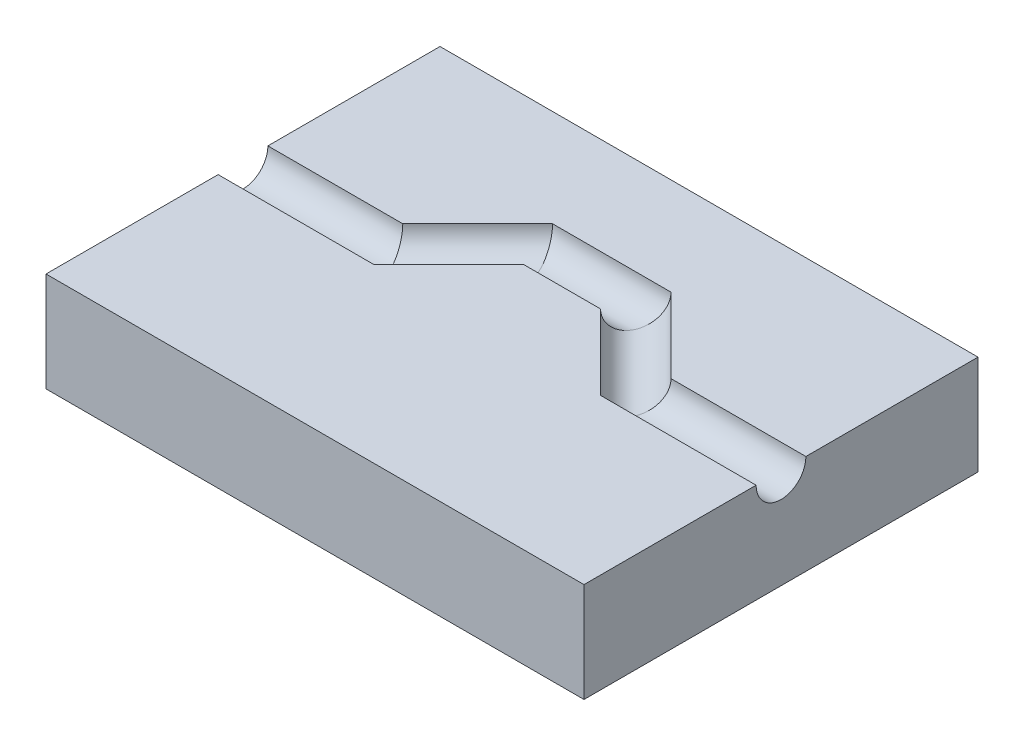
from build123d import *

# Parameters (mm, degrees)
SKETCH1_W            = 108.10925528
SKETCH1_H            = 79.176207514
BOSS_EXTRUDE1_DEPTH  = 20
CUT_SWEEP1_PROFILE_R = 5


with BuildPart() as part:
    # Sketch1 → Boss-Extrude1 (new body)
    with BuildSketch(Plane(origin=(0, 0, 0), x_dir=(1, 0, 0), z_dir=(0, 1, 0))):
        Rectangle(SKETCH1_W, SKETCH1_H)
    extrude(amount=BOSS_EXTRUDE1_DEPTH)

    # Cut-Sweep1: sweep along a path in Sketch2
    with BuildLine(Plane(origin=(0, 20, 0), x_dir=(1, 0, 0), z_dir=(0, 1, 0))) as cut_sweep1_path:
        Line((-54.05462764, 0), (-24.878423118, 0))
        Line((-24.878423118, 0), (-9.830238348, 15.04818477))
        Line((-9.830238348, 15.04818477), (9.830238348, 15.04818477))
        Line((9.830238348, 15.04818477), (24.878423118, 0))
        Line((24.878423118, 0), (54.05462764, 0))
    # Cut-Sweep1 profile (on start of the path) → Cut-Sweep1 (sweep, cut)
    with BuildSketch(Plane(origin=(-54.05462764, 20, 0), x_dir=(0, 0, 1), z_dir=(1, 0, 0))):
        Circle(CUT_SWEEP1_PROFILE_R)
    sweep(path=cut_sweep1_path.line, transition=Transition.RIGHT, mode=Mode.SUBTRACT)


solid = part.part
